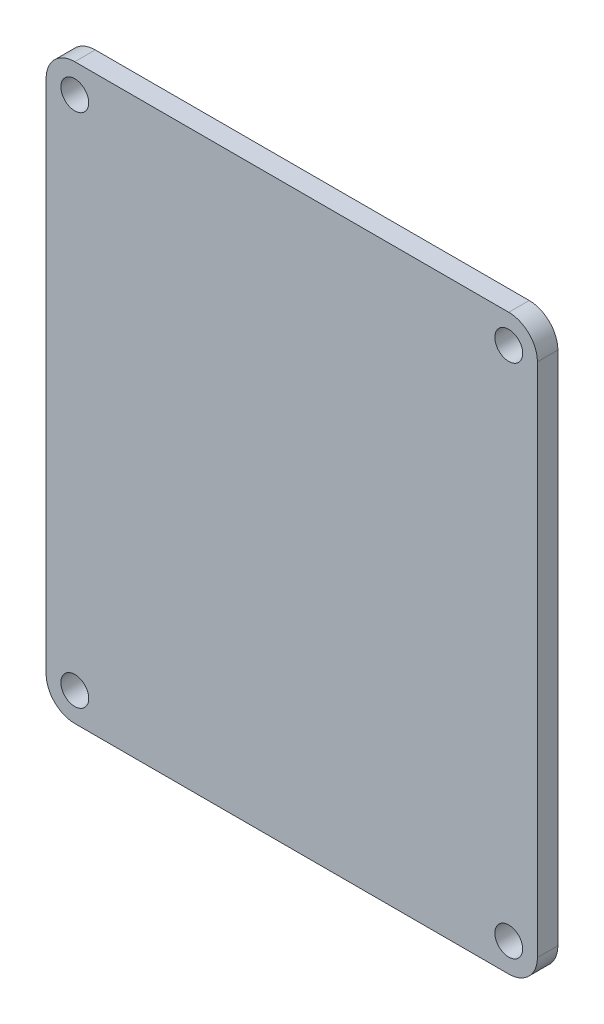
from build123d import *

# Parameters (mm, degrees)
SKETCH1_R           = 1.7
BOSS_EXTRUDE1_DEPTH = 2.5


with BuildPart() as part:
    # Sketch1 → Boss-Extrude1 (new body)
    with BuildSketch(Plane(origin=(0, 0, 0), x_dir=(0, 1, 0), z_dir=(0, 0, 1))):
        with BuildLine():
            Line((-31.5, -30), (31.5, -30))
            ThreePointArc((31.5, -30), (33.974873734, -28.974873734), (35, -26.5))
            Line((35, -26.5), (35, 26.5))
            ThreePointArc((35, 26.5), (33.974873734, 28.974873734), (31.5, 30))
            Line((31.5, 30), (-31.5, 30))
            ThreePointArc((-31.5, 30), (-33.974873734, 28.974873734), (-35, 26.5))
            Line((-35, 26.5), (-35, -26.5))
            ThreePointArc((-35, -26.5), (-33.974873734, -28.974873734), (-31.5, -30))
        make_face()
        with Locations(Location((-31.5, -26.5, 0), (0, 0, 270))):
            Circle(SKETCH1_R, mode=Mode.SUBTRACT)
        with Locations(Location((-31.5, 26.5, 0), (0, 0, 270))):
            Circle(SKETCH1_R, mode=Mode.SUBTRACT)
        with Locations(Location((31.5, 26.5, 0), (0, 0, 270))):
            Circle(SKETCH1_R, mode=Mode.SUBTRACT)
        with Locations(Location((31.5, -26.5, 0), (0, 0, 270))):
            Circle(SKETCH1_R, mode=Mode.SUBTRACT)
    extrude(amount=BOSS_EXTRUDE1_DEPTH)


solid = part.part
